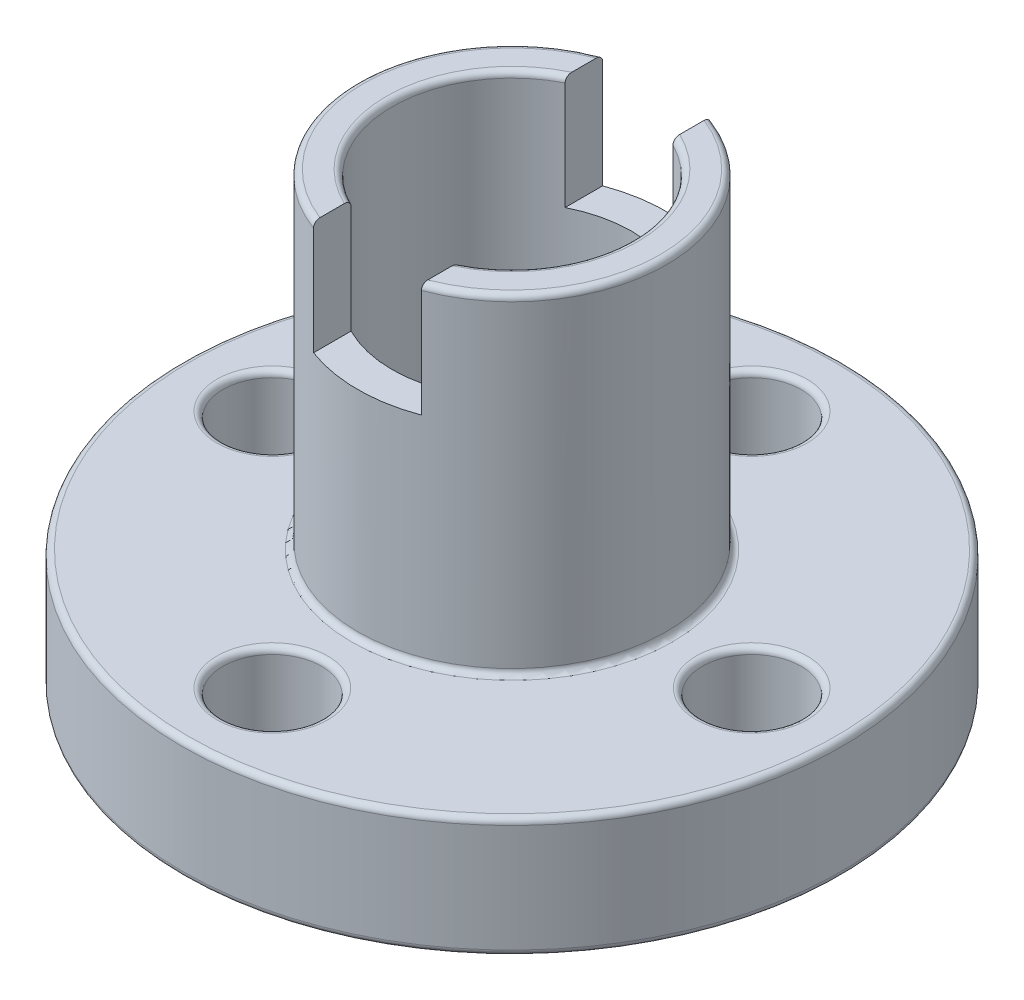
from build123d import *

# Parameters (mm, degrees)
SKETCH_1_R               = 11
SKETCH_1_R_2             = 1.65
SKETCH_1_R_3             = 5.15
EXTRUDE_1_DEPTH          = 4
SKETCH_1_3_R             = 5.15
SKETCH_1_3_R_2           = 4
EXTRUDE_2_DEPTH          = 15
FILLET_1_R               = 0.2
CUT_EXTRUDE_1_DEPTH      = 22.610182836
CUT_EXTRUDE_1_DEPTH_BACK = 22.610182836
SKETCH_2_W               = 3.6
SKETCH_2_H               = 3.8


with BuildPart() as part:
    # 草图1 → 凸台-拉伸1 (new body)
    with BuildSketch(Plane(origin=(0, 0, 0), x_dir=(1, 0, 0), z_dir=(0, 1, 0))):
        Circle(SKETCH_1_R)
        with Locations((0, -8)):
            Circle(SKETCH_1_R_2, mode=Mode.SUBTRACT)
        with Locations((8, 0)):
            Circle(SKETCH_1_R_2, mode=Mode.SUBTRACT)
        with Locations((-8, 0)):
            Circle(SKETCH_1_R_2, mode=Mode.SUBTRACT)
        Circle(SKETCH_1_R_3, mode=Mode.SUBTRACT)
        with Locations((0, 8)):
            Circle(SKETCH_1_R_2, mode=Mode.SUBTRACT)
    extrude(amount=EXTRUDE_1_DEPTH)

    # 草图1<3> → 凸台-拉伸2 (add)
    with BuildSketch(Plane(origin=(0, 0, 0), x_dir=(1, 0, 0), z_dir=(0, 1, 0))):
        Circle(SKETCH_1_3_R)
        Circle(SKETCH_1_3_R_2, mode=Mode.SUBTRACT)
    extrude(amount=EXTRUDE_2_DEPTH)

    # 圆角1
    fillet_1_edges = [part.edges().sort_by_distance(p)[0] for p in [
        (-5.15, 15, 0),
        (-4, 15, 0),
        (-11, 4, 0),
        (-5.15, 4, 0),
        (-1.65, 4, -8),
        (6.35, 4, 0),
        (-1.65, 4, 8),
        (-9.65, 4, 0),
        (-4, 0, 0),
        (-11, 0, 0),
        (-1.65, 0, -8),
        (6.35, 0, 0),
        (-1.65, 0, 8),
        (-9.65, 0, 0),
    ]]
    fillet(fillet_1_edges, radius=FILLET_1_R)

    # 草图2 → 切除-拉伸1 (cut, two sides: drawn at the far end of the back side and taken through both)
    with BuildSketch(Plane.XY.offset(-CUT_EXTRUDE_1_DEPTH_BACK)):
        with Locations((0, 13.1)):
            Rectangle(SKETCH_2_W, SKETCH_2_H)
    extrude(amount=CUT_EXTRUDE_1_DEPTH + CUT_EXTRUDE_1_DEPTH_BACK, mode=Mode.SUBTRACT)


solid = part.part
